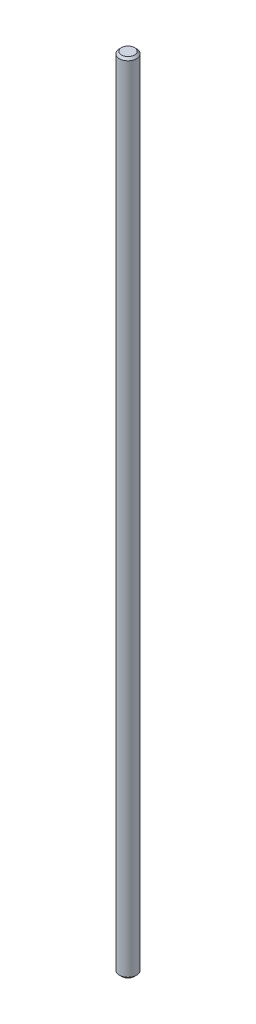
from build123d import *

# Parameters (mm, degrees)
SKETCH_1_R      = 4000
EXTRUDE_1_DEPTH = 370000
CHAMFER_1_SIZE  = 1000


with BuildPart() as part:
    # 草圖1 → 填料-伸長1 (new body)
    with BuildSketch(Plane(origin=(0, 0, 0), x_dir=(1, 0, 0), z_dir=(0, 1, 0))):
        with Locations(Location((0, 0, 0), (0, 0, 270))):
            Circle(SKETCH_1_R)
    extrude(amount=EXTRUDE_1_DEPTH)

    # 導角1
    chamfer_1_edges = [part.edges().sort_by_distance(p)[0] for p in [
        (0, 0, -4000),
        (0, 370000, -4000),
    ]]
    chamfer(chamfer_1_edges, length=CHAMFER_1_SIZE)


solid = part.part
